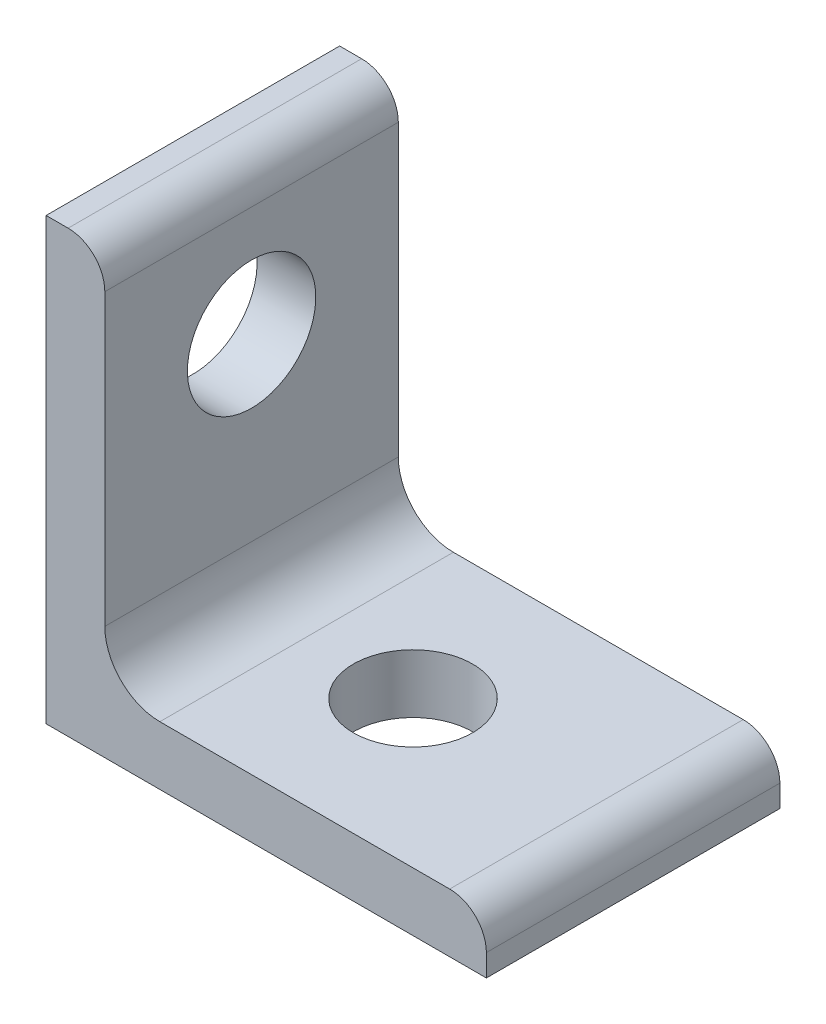
from build123d import *

# Parameters (mm, degrees)
EXTRUDE1_DEPTH          = 25.4
F_3_8_CLEARANCE_HOLE1_D = 10.31748
CUT_EXTRUDE1_REACH      = 58.454
SKETCH5_R               = 5.55625


with BuildPart() as part:
    # Sketch1 → Extrude1 (new body)
    with BuildSketch(Plane.XY):
        with BuildLine():
            Line((0, 0), (0, 38.1))
            Line((0, 38.1), (1.905, 38.1))
            ThreePointArc((1.905, 38.1), (4.15006403, 37.17006403), (5.08, 34.925))
            Line((5.08, 34.925), (5.08, 9.8425))
            ThreePointArc((5.08, 9.8425), (6.474903955, 6.474903955), (9.8425, 5.08))
            Line((9.8425, 5.08), (34.925, 5.08))
            ThreePointArc((34.925, 5.08), (37.17006403, 4.15006403), (38.1, 1.905))
            Line((38.1, 1.905), (38.1, 0))
            Line((38.1, 0), (0, 0))
        make_face()
    extrude(amount=EXTRUDE1_DEPTH)

    # 3/8 Clearance Hole1 (through all)
    with Locations(Plane(origin=(0, 5.08, 0), x_dir=(-1, 0, 0), z_dir=(0, 1, 0))):
        with Locations((-19.05, 12.7)):
            Hole(F_3_8_CLEARANCE_HOLE1_D / 2)

    # Sketch5 → Cut-Extrude1 (cut, up to next)
    with BuildSketch(Plane(origin=(5.08, 0, 0), x_dir=(0, 0, -1), z_dir=(1, 0, 0)), mode=Mode.PRIVATE) as cut_extrude1_sk1:
        with Locations(Location((-12.7, 25.4, 0), (0, 0, 90))):
            Circle(SKETCH5_R)
    cut_extrude1_tool1 = extrude(cut_extrude1_sk1.sketch, amount=-CUT_EXTRUDE1_REACH, mode=Mode.PRIVATE) & part.part
    add(cut_extrude1_tool1.solids().sort_by_distance((5.08, 25.4, 12.7))[0], mode=Mode.SUBTRACT)


solid = part.part
